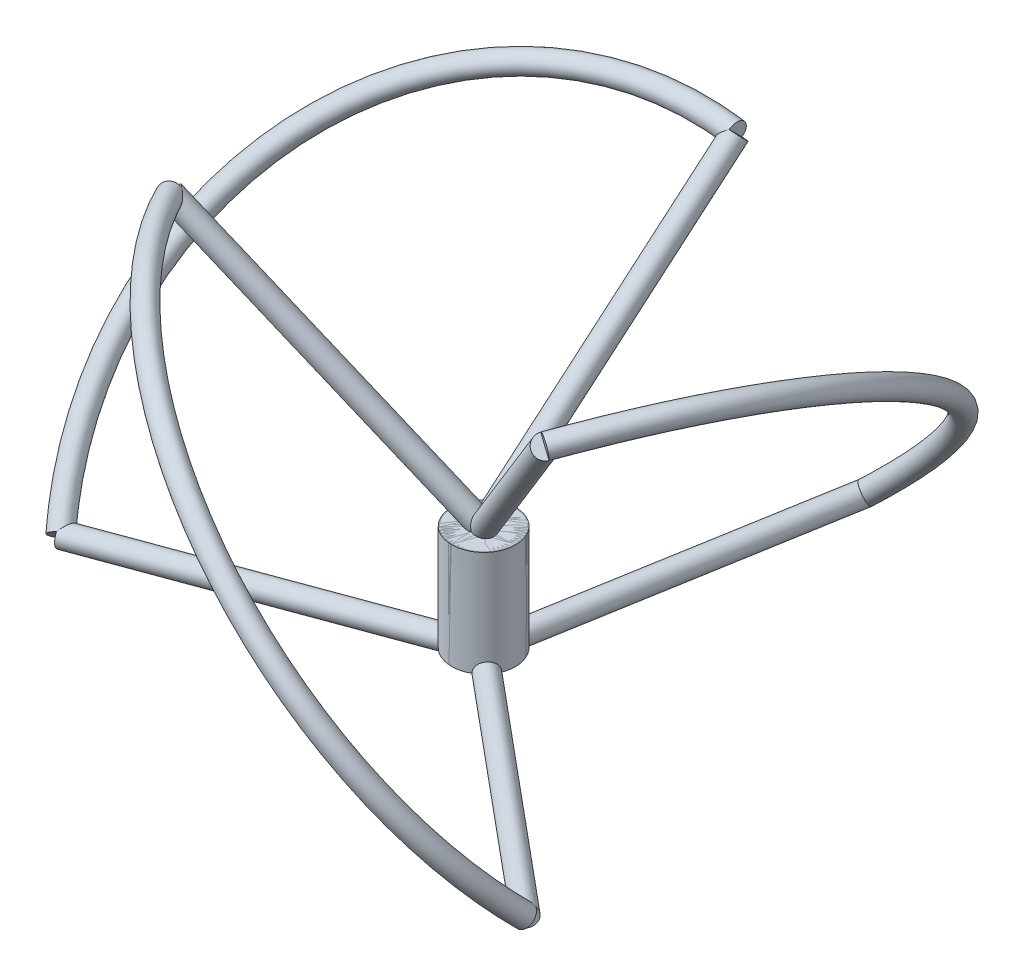
from build123d import *

# Parameters (mm, degrees)
SKETCH29_R          = 3
BOSS_EXTRUDE2_DEPTH = 10
SWEEP5_PROFILE_R    = 1
SWEEP6_PROFILE_R    = 1
SWEEP7_PROFILE_R    = 1
CIRPATTERN3_COUNT   = 3


with BuildPart() as part:
    # Sketch29 → Boss-Extrude2 (new body)
    with BuildSketch(Plane(origin=(0, 0, 0), x_dir=(1, 0, 0), z_dir=(0, 1, 0))):
        with Locations(Location((0, 0, 0), (0, 0, 270))):
            Circle(SKETCH29_R)
    extrude(amount=BOSS_EXTRUDE2_DEPTH)



with BuildPart() as body_2:
    # Sweep5: sweep along a curve in space
    with BuildLine() as sweep5_path:
        ThreePointArc((18.313751861, 32.007230683, 12.524008561), (23.431624112, 23.822539731, -18.395550161), (5.313128062, 0.007120402, -30.795017771))
    # Sweep5 profile (on start of the path) → Sweep5 (sweep)
    with BuildSketch(Plane(origin=(18.313751861, 32.007230683, 12.524008561), x_dir=(-0.8599803867747853, 0, -0.5103270856643715), z_dir=(0.5049049768893884, 0.14538451642635064, -0.8508432915030842))):
        Circle(SWEEP5_PROFILE_R)
    sweep(path=sweep5_path.line)


with BuildPart() as part_1:
    add(part.part)

    add(body_2.part)  # Sweep6 merges body 2
    # Sweep6: sweep along a curve in space
    with BuildLine() as sweep6_path:
        Line((0, 10, 0), (18.313751861, 32.007230683, 12.524008561))
    # Sweep6 profile (on start of the path) → Sweep6 (sweep)
    with BuildSketch(Plane(origin=(0, 10, 0), x_dir=(0.7686609641273732, -0.63965640950965, 0), z_dir=(0.586040059541794, 0.7042313818601121, 0.40076827396345577))):
        Circle(SWEEP6_PROFILE_R)
    sweep(path=sweep6_path.line)

    # Sweep7: sweep along a curve in space
    with BuildLine() as sweep7_path:
        Line((5.313128062, 0.007120402, -30.795017771), (0, 0, 0))
    # Sweep7 profile (on start of the path) → Sweep7 (sweep)
    with BuildSketch(Plane(origin=(5.313128062, 0.007120402, -30.795017771), x_dir=(0.9854405942433416, 0, 0.170020102391834), z_dir=(-0.17002009797837356, -0.00022785285578374998, 0.9854405686628191))):
        Circle(SWEEP7_PROFILE_R)
    sweep(path=sweep7_path.line)


with BuildPart() as cirpattern3_1:
    # CirPattern3: pattern copy
    add(part_1.part.rotate(Axis((-0.042610211, 0, -0.029132425), (0, 1, 0)), 1 * 360 / CIRPATTERN3_COUNT))


with BuildPart() as cirpattern3_2:
    # CirPattern3: pattern copy
    add(part_1.part.rotate(Axis((-0.042610211, 0, -0.029132425), (0, 1, 0)), 2 * 360 / CIRPATTERN3_COUNT))


solid = Compound([part_1.part, cirpattern3_1.part, cirpattern3_2.part])
